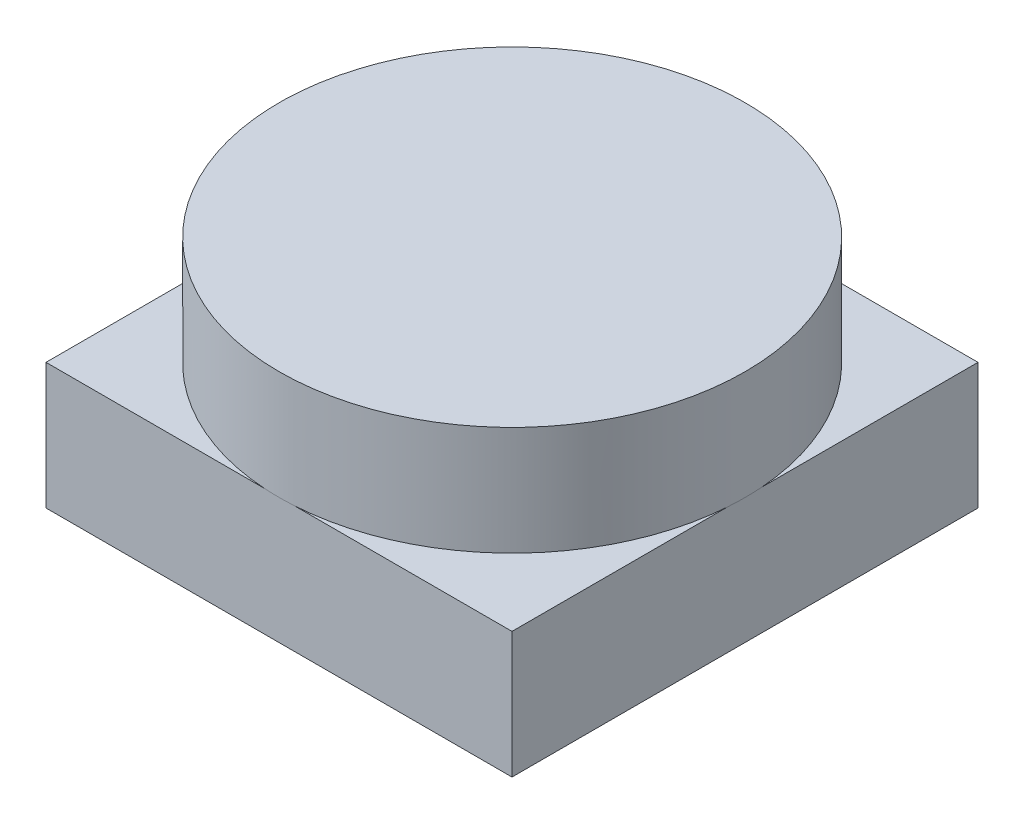
from build123d import *

# Parameters (mm, degrees)
SKETCH1_W           = 77
SKETCH1_H           = 77
BOSS_EXTRUDE1_DEPTH = 20.85
SKETCH3_R           = 38.5
BOSS_EXTRUDE2_DEPTH = 18


with BuildPart() as part:
    # Sketch1 → Boss-Extrude1 (new body)
    with BuildSketch(Plane(origin=(0, 0, 0), x_dir=(1, 0, 0), z_dir=(0, 1, 0))):
        with Locations((4.39746647, -0.844827586)):
            Rectangle(SKETCH1_W, SKETCH1_H)
    extrude(amount=BOSS_EXTRUDE1_DEPTH)

    # Sketch3 → Boss-Extrude2 (add)
    with BuildSketch(Plane(origin=(0, 20.85, 0), x_dir=(1, 0, 0), z_dir=(0, 1, 0))):
        with Locations(Location((4.500004963, -0.922846442, 0), (0, 0, 4.182608044))):
            Circle(SKETCH3_R)
    extrude(amount=BOSS_EXTRUDE2_DEPTH)


solid = part.part
